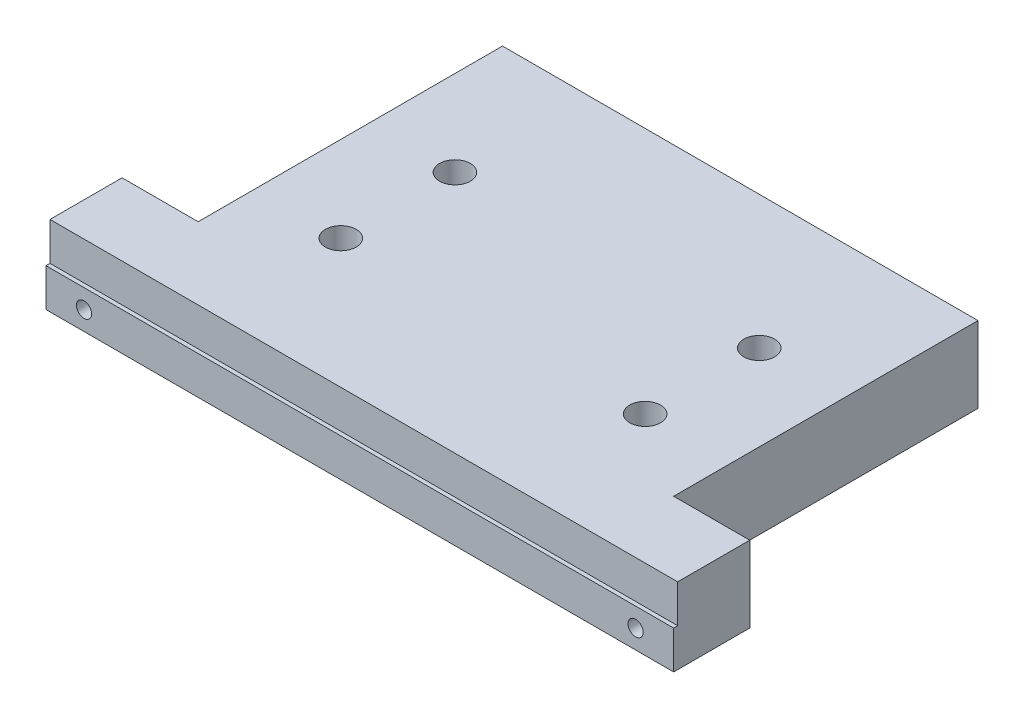
from build123d import *

# Parameters (mm, degrees)
SKETCH1_W               = 125
SKETCH1_H               = 20
BOSS_EXTRUDE1_DEPTH     = 100
SKETCH8_W               = 20
SKETCH8_H               = 20
BOSS_EXTRUDE2_DEPTH     = 20
SKETCH11_R              = 4.05
CUT_EXTRUDE3_DEPTH      = 40
SKETCH9_W               = 20
SKETCH9_H               = 20
BOSS_EXTRUDE3_DEPTH     = 20
SKETCH10_R              = 2
CUT_EXTRUDE2_DEPTH      = 20
ESQUISSE2_W             = 165
ESQUISSE2_H             = 1.05
ENL_V_MAT_EXTRU_1_DEPTH = 10


with BuildPart() as part:
    # Sketch1 → Boss-Extrude1 (new body)
    with BuildSketch(Plane.XY):
        with Locations((62.5, 10)):
            Rectangle(SKETCH1_W, SKETCH1_H)
    extrude(amount=BOSS_EXTRUDE1_DEPTH)

    # Sketch8 → Boss-Extrude2 (add)
    with BuildSketch(Plane.ZY):
        with Locations((90, 10)):
            Rectangle(SKETCH8_W, SKETCH8_H)
    extrude(amount=BOSS_EXTRUDE2_DEPTH)

    # Sketch11 → Cut-Extrude3 (cut)
    with BuildSketch(Plane(origin=(0, 20, 0), x_dir=(1, 0, 0), z_dir=(0, 1, 0))):
        with Locations(Location((22.5, -35, 0), (0, 0, 270))):
            Circle(SKETCH11_R)
        with Locations(Location((22.5, -65, 0), (0, 0, 270))):
            Circle(SKETCH11_R)
        with Locations(Location((102.5, -65, 0), (0, 0, 270))):
            Circle(SKETCH11_R)
        with Locations(Location((102.5, -35, 0), (0, 0, 270))):
            Circle(SKETCH11_R)
    extrude(amount=-CUT_EXTRUDE3_DEPTH, mode=Mode.SUBTRACT)

    # Sketch9 → Boss-Extrude3 (add)
    with BuildSketch(Plane(origin=(125, 0, 0), x_dir=(0, 0, -1), z_dir=(1, 0, 0))):
        with Locations((-90, 10)):
            Rectangle(SKETCH9_W, SKETCH9_H)
    extrude(amount=BOSS_EXTRUDE3_DEPTH)

    # Sketch10 → Cut-Extrude2 (cut)
    with BuildSketch(Plane(origin=(0, 0, 80), x_dir=(-1, 0, 0), z_dir=(0, 0, -1))):
        with Locations((10, 5)):
            Circle(SKETCH10_R)
        with Locations(Location((-135, 5, 0), (0, 0, 180))):
            Circle(SKETCH10_R)
    extrude(amount=-CUT_EXTRUDE2_DEPTH, mode=Mode.SUBTRACT)

    # Esquisse2 → Enlèv. mat.-Extru.1 (cut)
    with BuildSketch(Plane(origin=(0, 20, 0), x_dir=(1, 0, 0), z_dir=(0, 1, 0))):
        with Locations((62.5, -99.475)):
            Rectangle(ESQUISSE2_W, ESQUISSE2_H)
    extrude(amount=-ENL_V_MAT_EXTRU_1_DEPTH, mode=Mode.SUBTRACT)


solid = part.part
